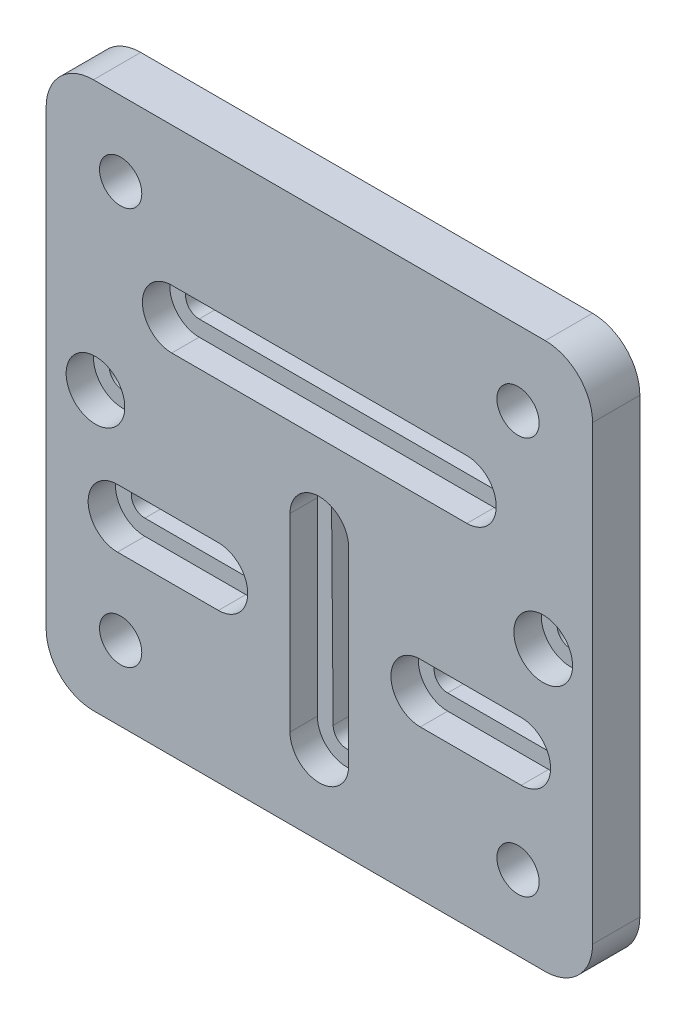
from build123d import *

# Parameters (mm, degrees)
SKETCH1_W           = 109.99978
SKETCH1_H           = 109.99978
BOSS_EXTRUDE1_DEPTH = 9.525
SKETCH2_R           = 5.9055
CUT_EXTRUDE1_DEPTH  = 5.5118
SKETCH3_R           = 2.7305
CUT_EXTRUDE3_DEPTH  = 79.362627732
SKETCH4_R           = 4.2545
CUT_EXTRUDE4_DEPTH  = 79.362627732
FILLET1_R           = 9.525


with BuildPart() as part:
    # Sketch1 → Boss-Extrude1 (new body)
    with BuildSketch(Plane.XY):
        Rectangle(SKETCH1_W, SKETCH1_H)
    extrude(amount=-BOSS_EXTRUDE1_DEPTH)

    # Sketch2 → Cut-Extrude1 (cut)
    with BuildSketch(Plane.XY):
        with Locations((45.06849, 1.06299)):
            Circle(SKETCH2_R)
        with Locations(Location((-45.06849, 1.06299, 0), (0, 0, 180))):
            Circle(SKETCH2_R)
        with BuildLine():
            Line((-29.7053, 27.05989), (29.7053, 27.05989))
            ThreePointArc((29.7053, 27.05989), (35.6108, 21.15439), (29.7053, 15.24889))
            Line((29.7053, 15.24889), (-29.7053, 15.24889))
            ThreePointArc((-29.7053, 15.24889), (-35.6108, 21.15439), (-29.7053, 27.05989))
        make_face()
        with BuildLine():
            Line((-5.9055, -0.8255), (-5.9055, -38.9255))
            ThreePointArc((-5.9055, -38.9255), (0, -44.831), (5.9055, -38.9255))
            Line((5.9055, -38.9255), (5.9055, -0.8255))
            ThreePointArc((5.9055, -0.8255), (0, 5.08), (-5.9055, -0.8255))
        make_face()
        with BuildLine():
            Line((20.32, -13.12291), (40.64, -13.12291))
            ThreePointArc((40.64, -13.12291), (46.5455, -19.02841), (40.64, -24.93391))
            Line((40.64, -24.93391), (20.32, -24.93391))
            ThreePointArc((20.32, -24.93391), (14.4145, -19.02841), (20.32, -13.12291))
        make_face()
        with BuildLine():
            Line((-20.32, -13.12291), (-40.64, -13.12291))
            ThreePointArc((-40.64, -13.12291), (-46.5455, -19.02841), (-40.64, -24.93391))
            Line((-40.64, -24.93391), (-20.32, -24.93391))
            ThreePointArc((-20.32, -24.93391), (-14.4145, -19.02841), (-20.32, -13.12291))
        make_face()
    extrude(amount=-CUT_EXTRUDE1_DEPTH, mode=Mode.SUBTRACT)

    # Sketch3 → Cut-Extrude3 (cut, through all)
    with BuildSketch(Plane.XY):
        with BuildLine():
            ThreePointArc((29.7053, 23.88489), (32.4358, 21.15439), (29.7053, 18.42389))
            Line((29.7053, 18.42389), (-29.7053, 18.42389))
            ThreePointArc((-29.7053, 18.42389), (-32.4358, 21.15439), (-29.7053, 23.88489))
            Line((-29.7053, 23.88489), (29.7053, 23.88489))
        make_face()
        with BuildLine():
            Line((3.048, -0.8255), (2.7305, -38.9255))
            ThreePointArc((2.7305, -38.9255), (0, -41.656), (-2.7305, -38.9255))
            Line((-2.7305, -38.9255), (-3.048, -0.8255))
            ThreePointArc((-3.048, -0.8255), (0, 2.2225), (3.048, -0.8255))
        make_face()
        with BuildLine():
            Line((-20.32, -16.29791), (-40.64, -16.29791))
            ThreePointArc((-40.64, -16.29791), (-43.3705, -19.02841), (-40.64, -21.75891))
            Line((-40.64, -21.75891), (-20.32, -21.75891))
            ThreePointArc((-20.32, -21.75891), (-17.5895, -19.02841), (-20.32, -16.29791))
        make_face()
        with BuildLine():
            ThreePointArc((40.64, -16.29791), (43.3705, -19.02841), (40.64, -21.75891))
            Line((40.64, -21.75891), (20.32, -21.75891))
            ThreePointArc((20.32, -21.75891), (17.5895, -19.02841), (20.32, -16.29791))
            Line((20.32, -16.29791), (40.64, -16.29791))
        make_face()
        with Locations((-45.06849, 1.06299)):
            Circle(SKETCH3_R)
        with Locations((45.06849, 1.06299)):
            Circle(SKETCH3_R)
    extrude(amount=-CUT_EXTRUDE3_DEPTH, mode=Mode.SUBTRACT)

    # Sketch4 → Cut-Extrude4 (cut, through all)
    with BuildSketch(Plane.XY):
        with Locations((-39.99865, -39.99865)):
            Circle(SKETCH4_R)
        with Locations((-39.99865, 39.99865)):
            Circle(SKETCH4_R)
        with Locations((39.99865, -39.99865)):
            Circle(SKETCH4_R)
        with Locations((39.99865, 39.99865)):
            Circle(SKETCH4_R)
    extrude(amount=-CUT_EXTRUDE4_DEPTH, mode=Mode.SUBTRACT)

    # Fillet1
    fillet1_edges = [part.edges().sort_by_distance(p)[0] for p in [
        (-54.99989, 54.99989, -4.7625),
        (-54.99989, -54.99989, -4.7625),
        (54.99989, -54.99989, -4.7625),
        (54.99989, 54.99989, -4.7625),
    ]]
    fillet(fillet1_edges, radius=FILLET1_R)


solid = part.part
